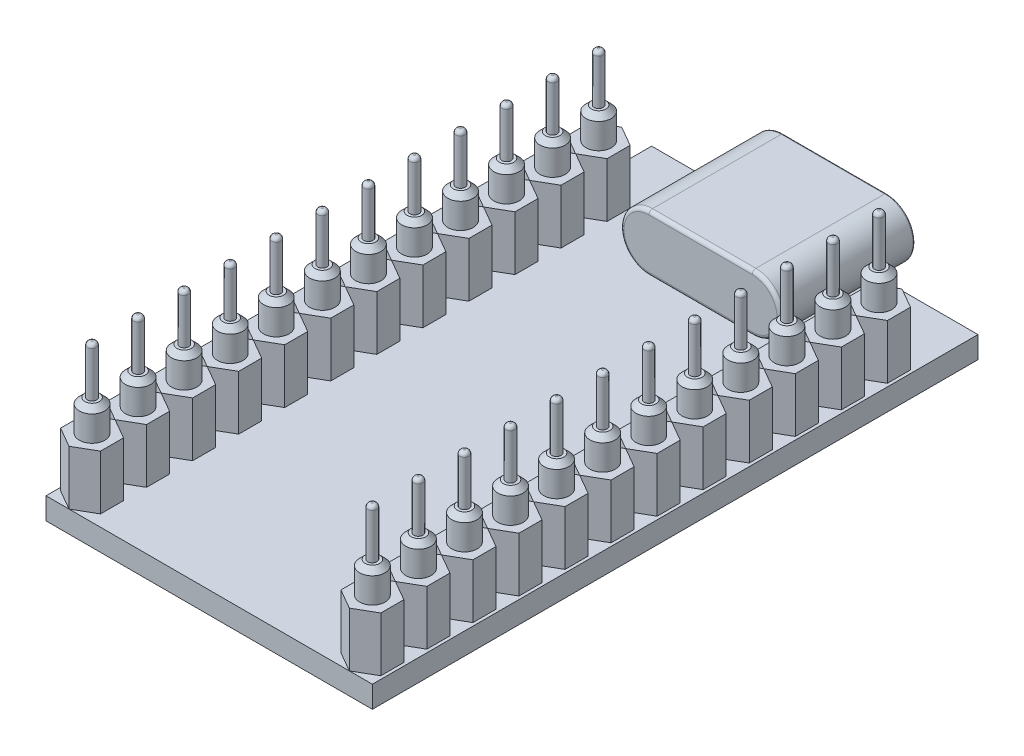
from build123d import *

# Parameters (mm, degrees)
SKETCH1_W                = 18
SKETCH1_H                = 33.4
BOSS_EXTRUDE1_DEPTH      = 1.2
BOSS_EXTRUDE2_DEPTH      = 1.1
BOSS_EXTRUDE2_DEPTH_BACK = 6.3
FILLET1_R                = 0.1
FILLET3_R                = 0.2
CUT_EXTRUDE2_DEPTH       = 7
FILLET4_R                = 0.1
SKETCH4_R                = 0.5
CUT_EXTRUDE3_DEPTH       = 7
CUT_EXTRUDE6_START       = 0.6
SKETCH7_R                = 1
CUT_EXTRUDE6_DEPTH       = 0.1
BOSS_EXTRUDE3_DEPTH      = 7.4
BOSS_EXTRUDE3_DEPTH_BACK = 1.6
SKETCH9_R                = 0.25
FILLET5_R                = 0.2
BOSS_EXTRUDE4_DEPTH      = 3
SKETCH11_R               = 0.7
BOSS_EXTRUDE5_DEPTH      = 4.7
CHAMFER1_SIZE            = 0.3
LPATTERN2_COUNT          = 12
LPATTERN2_PITCH          = 2.54


with BuildPart() as part:
    # Sketch1 → Boss-Extrude1 (new body)
    with BuildSketch(Plane(origin=(0, 0, 0), x_dir=(1, 0, 0), z_dir=(0, 1, 0))):
        Rectangle(SKETCH1_W, SKETCH1_H)
    extrude(amount=BOSS_EXTRUDE1_DEPTH)

    # Sketch4 → Cut-Extrude3 (cut)
    with BuildSketch(Plane(origin=(0, 1.2, 0), x_dir=(1, 0, 0), z_dir=(0, 1, 0))):
        with Locations(Location((-7.73, -15.43, 0), (0, 0, 270))):
            Circle(SKETCH4_R)
        with Locations(Location((-7.73, -12.89, 0), (0, 0, 270))):
            Circle(SKETCH4_R)
        with Locations(Location((-7.73, -10.35, 0), (0, 0, 270))):
            Circle(SKETCH4_R)
        with Locations(Location((-7.73, -7.81, 0), (0, 0, 270))):
            Circle(SKETCH4_R)
        with Locations(Location((-7.73, -5.27, 0), (0, 0, 270))):
            Circle(SKETCH4_R)
        with Locations(Location((-7.73, -2.73, 0), (0, 0, 270))):
            Circle(SKETCH4_R)
        with Locations(Location((-7.73, -0.19, 0), (0, 0, 270))):
            Circle(SKETCH4_R)
        with Locations(Location((-7.73, 2.35, 0), (0, 0, 270))):
            Circle(SKETCH4_R)
        with Locations(Location((-7.73, 4.89, 0), (0, 0, 270))):
            Circle(SKETCH4_R)
        with Locations(Location((-7.73, 7.43, 0), (0, 0, 270))):
            Circle(SKETCH4_R)
        with Locations(Location((-7.73, 9.97, 0), (0, 0, 270))):
            Circle(SKETCH4_R)
        with Locations(Location((-7.73, 12.51, 0), (0, 0, 270))):
            Circle(SKETCH4_R)
    cut_extrude3 = extrude(amount=-CUT_EXTRUDE3_DEPTH, mode=Mode.SUBTRACT)

    # Sketch7 → Cut-Extrude6 (cut)
    with BuildSketch(Plane(origin=(0, 0.6, 0), x_dir=(-1, 0, 0), z_dir=(0, -1, 0)).offset(CUT_EXTRUDE6_START)):
        with Locations(Location((7.73, -15.43, 0), (0, 0, 90))):
            Circle(SKETCH7_R)
        with Locations(Location((7.73, -12.89, 0), (0, 0, 90))):
            Circle(SKETCH7_R)
        with Locations(Location((7.73, -10.35, 0), (0, 0, 90))):
            Circle(SKETCH7_R)
        with Locations(Location((7.73, -7.81, 0), (0, 0, 90))):
            Circle(SKETCH7_R)
        with Locations(Location((7.73, -5.27, 0), (0, 0, 90))):
            Circle(SKETCH7_R)
        with Locations(Location((7.73, -2.73, 0), (0, 0, 90))):
            Circle(SKETCH7_R)
        with Locations(Location((7.73, -0.19, 0), (0, 0, 90))):
            Circle(SKETCH7_R)
        with Locations(Location((7.73, 2.35, 0), (0, 0, 90))):
            Circle(SKETCH7_R)
        with Locations(Location((7.73, 4.89, 0), (0, 0, 90))):
            Circle(SKETCH7_R)
        with Locations(Location((7.73, 7.43, 0), (0, 0, 90))):
            Circle(SKETCH7_R)
        with Locations(Location((7.73, 9.97, 0), (0, 0, 90))):
            Circle(SKETCH7_R)
        with Locations(Location((7.73, 12.51, 0), (0, 0, 90))):
            Circle(SKETCH7_R)
    cut_extrude6 = extrude(amount=-CUT_EXTRUDE6_DEPTH, mode=Mode.SUBTRACT)

    # Mirror5: Cut-Extrude3, Cut-Extrude6 across plane
    add(cut_extrude3.mirror(Plane(origin=(0, 0, 0), x_dir=(0, 0, 1), z_dir=(1, 0, 0))), mode=Mode.SUBTRACT)
    add(cut_extrude6.mirror(Plane(origin=(0, 0, 0), x_dir=(0, 0, 1), z_dir=(1, 0, 0))), mode=Mode.SUBTRACT)


with BuildPart() as body_2:
    # Sketch2 → Boss-Extrude2 (new, two sides: drawn at the far end of the back side and taken through both)
    with BuildSketch(Plane(origin=(0, 0, -16.7), x_dir=(-1, 0, 0), z_dir=(0, 0, -1)).offset(-BOSS_EXTRUDE2_DEPTH_BACK)):
        with BuildLine():
            Line((-2.85, 4.34), (2.85, 4.34))
            ThreePointArc((2.85, 4.34), (4.42, 2.77), (2.85, 1.2))
            Line((2.85, 1.2), (-2.85, 1.2))
            ThreePointArc((-2.85, 1.2), (-4.42, 2.77), (-2.85, 4.34))
        make_face()
    extrude(amount=BOSS_EXTRUDE2_DEPTH + BOSS_EXTRUDE2_DEPTH_BACK)

    # Fillet1
    fillet1_edges = [body_2.edges().sort_by_distance(p)[0] for p in [
        (4.42, 2.77, -17.8),
        (0, 1.2, -17.8),
        (-4.42, 2.77, -17.8),
        (0, 4.34, -17.8),
    ]]
    fillet(fillet1_edges, radius=FILLET1_R)

    # Fillet3
    fillet3_edges = [body_2.edges().sort_by_distance(p)[0] for p in [
        (-4.42, 2.77, -10.4),
        (0, 4.34, -10.4),
        (4.42, 2.77, -10.4),
        (0, 1.2, -10.4),
    ]]
    fillet(fillet3_edges, radius=FILLET3_R)

    # Sketch3 → Cut-Extrude2 (cut)
    with BuildSketch(Plane(origin=(0, 0, -17.8), x_dir=(-1, 0, 0), z_dir=(0, 0, -1))):
        with BuildLine():
            Line((-2.85, 1.5), (2.85, 1.5))
            ThreePointArc((2.85, 1.5), (4.12, 2.77), (2.85, 4.04))
            Line((2.85, 4.04), (-2.85, 4.04))
            ThreePointArc((-2.85, 4.04), (-4.12, 2.77), (-2.85, 1.5))
        make_face()
        with BuildLine():
            Line((-2.85, 3.02), (2.85, 3.02))
            ThreePointArc((2.85, 3.02), (3.1, 2.77), (2.85, 2.52))
            Line((2.85, 2.52), (-2.85, 2.52))
            ThreePointArc((-2.85, 2.52), (-3.1, 2.77), (-2.85, 3.02))
        make_face(mode=Mode.SUBTRACT)
    extrude(amount=-CUT_EXTRUDE2_DEPTH, mode=Mode.SUBTRACT)

    # Fillet4
    fillet4_edges = [body_2.edges().sort_by_distance(p)[0] for p in [
        (4.12, 2.77, -17.8),
        (0, 1.5, -17.8),
        (-4.12, 2.77, -17.8),
        (0, 4.04, -17.8),
        (3.1, 2.77, -17.8),
        (0, 3.02, -17.8),
        (-3.1, 2.77, -17.8),
        (0, 2.52, -17.8),
    ]]
    fillet(fillet4_edges, radius=FILLET4_R)


with BuildPart() as body_3:
    # Sketch9 → Boss-Extrude3 (new, two sides: drawn at the far end of the back side and taken through both)
    with BuildSketch(Plane(origin=(0, 1.2, 0), x_dir=(1, 0, 0), z_dir=(0, 1, 0)).offset(-BOSS_EXTRUDE3_DEPTH_BACK)):
        with Locations(Location((-7.73, -15.43, 0), (0, 0, 270))):
            Circle(SKETCH9_R)
    extrude(amount=BOSS_EXTRUDE3_DEPTH + BOSS_EXTRUDE3_DEPTH_BACK)

    # Fillet5
    fillet5_edges = [body_3.edges().sort_by_distance(p)[0] for p in [
        (-7.73, 8.6, 15.18),
        (-7.73, -0.4, 15.18),
    ]]
    fillet(fillet5_edges, radius=FILLET5_R)


with BuildPart() as body_4:
    # Sketch10 → Boss-Extrude4 (new body)
    with BuildSketch(Plane(origin=(0, 1.2, 0), x_dir=(1, 0, 0), z_dir=(0, 1, 0))):
        Polygon((-8.829852263, -14.795), (-8.829852263, -16.065), (-7.73, -16.7), (-6.630147737, -16.065), (-6.630147737, -14.795), (-7.73, -14.16), align=None)
    extrude(amount=BOSS_EXTRUDE4_DEPTH)


with BuildPart() as body_5:
    # Sketch11 → Boss-Extrude5 (new body)
    with BuildSketch(Plane(origin=(0, 1.2, 0), x_dir=(1, 0, 0), z_dir=(0, 1, 0))):
        with Locations(Location((-7.73, -15.43, 0), (0, 0, 270))):
            Circle(SKETCH11_R)
    extrude(amount=BOSS_EXTRUDE5_DEPTH)

    # Chamfer1
    chamfer1_edges = [body_5.edges().sort_by_distance(p)[0] for p in [
        (-7.73, 5.9, 14.73),
    ]]
    chamfer(chamfer1_edges, length=CHAMFER1_SIZE)


with BuildPart() as lpattern2_1:
    # LPattern2: pattern copy
    add(body_3.part.moved(Location(Vector(0, 0, -1) * (1 * LPATTERN2_PITCH))))


with BuildPart() as lpattern2_2:
    # LPattern2: pattern copy
    add(body_3.part.moved(Location(Vector(0, 0, -1) * (2 * LPATTERN2_PITCH))))


with BuildPart() as lpattern2_3:
    # LPattern2: pattern copy
    add(body_3.part.moved(Location(Vector(0, 0, -1) * (3 * LPATTERN2_PITCH))))


with BuildPart() as lpattern2_4:
    # LPattern2: pattern copy
    add(body_3.part.moved(Location(Vector(0, 0, -1) * (4 * LPATTERN2_PITCH))))


with BuildPart() as lpattern2_5:
    # LPattern2: pattern copy
    add(body_3.part.moved(Location(Vector(0, 0, -1) * (5 * LPATTERN2_PITCH))))


with BuildPart() as lpattern2_6:
    # LPattern2: pattern copy
    add(body_3.part.moved(Location(Vector(0, 0, -1) * (6 * LPATTERN2_PITCH))))


with BuildPart() as lpattern2_7:
    # LPattern2: pattern copy
    add(body_3.part.moved(Location(Vector(0, 0, -1) * (7 * LPATTERN2_PITCH))))


with BuildPart() as lpattern2_8:
    # LPattern2: pattern copy
    add(body_3.part.moved(Location(Vector(0, 0, -1) * (8 * LPATTERN2_PITCH))))


with BuildPart() as lpattern2_9:
    # LPattern2: pattern copy
    add(body_3.part.moved(Location(Vector(0, 0, -1) * (9 * LPATTERN2_PITCH))))


with BuildPart() as lpattern2_10:
    # LPattern2: pattern copy
    add(body_3.part.moved(Location(Vector(0, 0, -1) * (10 * LPATTERN2_PITCH))))


with BuildPart() as lpattern2_11:
    # LPattern2: pattern copy
    add(body_3.part.moved(Location(Vector(0, 0, -1) * (11 * LPATTERN2_PITCH))))


with BuildPart() as lpattern2_12:
    # LPattern2: pattern copy
    add(body_5.part.moved(Location(Vector(0, 0, -1) * (1 * LPATTERN2_PITCH))))


with BuildPart() as lpattern2_13:
    # LPattern2: pattern copy
    add(body_5.part.moved(Location(Vector(0, 0, -1) * (2 * LPATTERN2_PITCH))))


with BuildPart() as lpattern2_14:
    # LPattern2: pattern copy
    add(body_5.part.moved(Location(Vector(0, 0, -1) * (3 * LPATTERN2_PITCH))))


with BuildPart() as lpattern2_15:
    # LPattern2: pattern copy
    add(body_5.part.moved(Location(Vector(0, 0, -1) * (4 * LPATTERN2_PITCH))))


with BuildPart() as lpattern2_16:
    # LPattern2: pattern copy
    add(body_5.part.moved(Location(Vector(0, 0, -1) * (5 * LPATTERN2_PITCH))))


with BuildPart() as lpattern2_17:
    # LPattern2: pattern copy
    add(body_5.part.moved(Location(Vector(0, 0, -1) * (6 * LPATTERN2_PITCH))))


with BuildPart() as lpattern2_18:
    # LPattern2: pattern copy
    add(body_5.part.moved(Location(Vector(0, 0, -1) * (7 * LPATTERN2_PITCH))))


with BuildPart() as lpattern2_19:
    # LPattern2: pattern copy
    add(body_5.part.moved(Location(Vector(0, 0, -1) * (8 * LPATTERN2_PITCH))))


with BuildPart() as lpattern2_20:
    # LPattern2: pattern copy
    add(body_5.part.moved(Location(Vector(0, 0, -1) * (9 * LPATTERN2_PITCH))))


with BuildPart() as lpattern2_21:
    # LPattern2: pattern copy
    add(body_5.part.moved(Location(Vector(0, 0, -1) * (10 * LPATTERN2_PITCH))))


with BuildPart() as lpattern2_22:
    # LPattern2: pattern copy
    add(body_5.part.moved(Location(Vector(0, 0, -1) * (11 * LPATTERN2_PITCH))))


with BuildPart() as lpattern2_23:
    # LPattern2: pattern copy
    add(body_4.part.moved(Location(Vector(0, 0, -1) * (1 * LPATTERN2_PITCH))))


with BuildPart() as lpattern2_24:
    # LPattern2: pattern copy
    add(body_4.part.moved(Location(Vector(0, 0, -1) * (2 * LPATTERN2_PITCH))))


with BuildPart() as lpattern2_25:
    # LPattern2: pattern copy
    add(body_4.part.moved(Location(Vector(0, 0, -1) * (3 * LPATTERN2_PITCH))))


with BuildPart() as lpattern2_26:
    # LPattern2: pattern copy
    add(body_4.part.moved(Location(Vector(0, 0, -1) * (4 * LPATTERN2_PITCH))))


with BuildPart() as lpattern2_27:
    # LPattern2: pattern copy
    add(body_4.part.moved(Location(Vector(0, 0, -1) * (5 * LPATTERN2_PITCH))))


with BuildPart() as lpattern2_28:
    # LPattern2: pattern copy
    add(body_4.part.moved(Location(Vector(0, 0, -1) * (6 * LPATTERN2_PITCH))))


with BuildPart() as lpattern2_29:
    # LPattern2: pattern copy
    add(body_4.part.moved(Location(Vector(0, 0, -1) * (7 * LPATTERN2_PITCH))))


with BuildPart() as lpattern2_30:
    # LPattern2: pattern copy
    add(body_4.part.moved(Location(Vector(0, 0, -1) * (8 * LPATTERN2_PITCH))))


with BuildPart() as lpattern2_31:
    # LPattern2: pattern copy
    add(body_4.part.moved(Location(Vector(0, 0, -1) * (9 * LPATTERN2_PITCH))))


with BuildPart() as lpattern2_32:
    # LPattern2: pattern copy
    add(body_4.part.moved(Location(Vector(0, 0, -1) * (10 * LPATTERN2_PITCH))))


with BuildPart() as lpattern2_33:
    # LPattern2: pattern copy
    add(body_4.part.moved(Location(Vector(0, 0, -1) * (11 * LPATTERN2_PITCH))))


with BuildPart() as body_39:
    # Mirror2: mirrored copy
    add(lpattern2_6.part.mirror(Plane(origin=(0, 0, 0), x_dir=(0, 0, 1), z_dir=(1, 0, 0))))


with BuildPart() as body_40:
    # Mirror2 2: mirrored copy
    add(lpattern2_13.part.mirror(Plane(origin=(0, 0, 0), x_dir=(0, 0, 1), z_dir=(1, 0, 0))))


with BuildPart() as body_41:
    # Mirror2 3: mirrored copy
    add(lpattern2_10.part.mirror(Plane(origin=(0, 0, 0), x_dir=(0, 0, 1), z_dir=(1, 0, 0))))


with BuildPart() as body_42:
    # Mirror2 4: mirrored copy
    add(lpattern2_18.part.mirror(Plane(origin=(0, 0, 0), x_dir=(0, 0, 1), z_dir=(1, 0, 0))))


with BuildPart() as body_43:
    # Mirror2 5: mirrored copy
    add(lpattern2_29.part.mirror(Plane(origin=(0, 0, 0), x_dir=(0, 0, 1), z_dir=(1, 0, 0))))


with BuildPart() as body_44:
    # Mirror2 6: mirrored copy
    add(lpattern2_23.part.mirror(Plane(origin=(0, 0, 0), x_dir=(0, 0, 1), z_dir=(1, 0, 0))))


with BuildPart() as body_45:
    # Mirror2 7: mirrored copy
    add(lpattern2_1.part.mirror(Plane(origin=(0, 0, 0), x_dir=(0, 0, 1), z_dir=(1, 0, 0))))


with BuildPart() as body_46:
    # Mirror2 8: mirrored copy
    add(body_5.part.mirror(Plane(origin=(0, 0, 0), x_dir=(0, 0, 1), z_dir=(1, 0, 0))))


with BuildPart() as body_47:
    # Mirror2 9: mirrored copy
    add(lpattern2_5.part.mirror(Plane(origin=(0, 0, 0), x_dir=(0, 0, 1), z_dir=(1, 0, 0))))


with BuildPart() as body_48:
    # Mirror2 10: mirrored copy
    add(lpattern2_16.part.mirror(Plane(origin=(0, 0, 0), x_dir=(0, 0, 1), z_dir=(1, 0, 0))))


with BuildPart() as body_49:
    # Mirror2 11: mirrored copy
    add(lpattern2_28.part.mirror(Plane(origin=(0, 0, 0), x_dir=(0, 0, 1), z_dir=(1, 0, 0))))


with BuildPart() as body_50:
    # Mirror2 12: mirrored copy
    add(body_4.part.mirror(Plane(origin=(0, 0, 0), x_dir=(0, 0, 1), z_dir=(1, 0, 0))))


with BuildPart() as body_51:
    # Mirror2 13: mirrored copy
    add(lpattern2_9.part.mirror(Plane(origin=(0, 0, 0), x_dir=(0, 0, 1), z_dir=(1, 0, 0))))


with BuildPart() as body_52:
    # Mirror2 14: mirrored copy
    add(lpattern2_21.part.mirror(Plane(origin=(0, 0, 0), x_dir=(0, 0, 1), z_dir=(1, 0, 0))))


with BuildPart() as body_53:
    # Mirror2 15: mirrored copy
    add(lpattern2_33.part.mirror(Plane(origin=(0, 0, 0), x_dir=(0, 0, 1), z_dir=(1, 0, 0))))


with BuildPart() as body_54:
    # Mirror2 16: mirrored copy
    add(lpattern2_14.part.mirror(Plane(origin=(0, 0, 0), x_dir=(0, 0, 1), z_dir=(1, 0, 0))))


with BuildPart() as body_55:
    # Mirror2 17: mirrored copy
    add(lpattern2_27.part.mirror(Plane(origin=(0, 0, 0), x_dir=(0, 0, 1), z_dir=(1, 0, 0))))


with BuildPart() as body_56:
    # Mirror2 18: mirrored copy
    add(lpattern2_4.part.mirror(Plane(origin=(0, 0, 0), x_dir=(0, 0, 1), z_dir=(1, 0, 0))))


with BuildPart() as body_57:
    # Mirror2 19: mirrored copy
    add(lpattern2_19.part.mirror(Plane(origin=(0, 0, 0), x_dir=(0, 0, 1), z_dir=(1, 0, 0))))


with BuildPart() as body_58:
    # Mirror2 20: mirrored copy
    add(lpattern2_8.part.mirror(Plane(origin=(0, 0, 0), x_dir=(0, 0, 1), z_dir=(1, 0, 0))))


with BuildPart() as body_59:
    # Mirror2 21: mirrored copy
    add(lpattern2_32.part.mirror(Plane(origin=(0, 0, 0), x_dir=(0, 0, 1), z_dir=(1, 0, 0))))


with BuildPart() as body_60:
    # Mirror2 22: mirrored copy
    add(lpattern2_12.part.mirror(Plane(origin=(0, 0, 0), x_dir=(0, 0, 1), z_dir=(1, 0, 0))))


with BuildPart() as body_61:
    # Mirror2 23: mirrored copy
    add(lpattern2_26.part.mirror(Plane(origin=(0, 0, 0), x_dir=(0, 0, 1), z_dir=(1, 0, 0))))


with BuildPart() as body_62:
    # Mirror2 24: mirrored copy
    add(lpattern2_17.part.mirror(Plane(origin=(0, 0, 0), x_dir=(0, 0, 1), z_dir=(1, 0, 0))))


with BuildPart() as body_63:
    # Mirror2 25: mirrored copy
    add(lpattern2_3.part.mirror(Plane(origin=(0, 0, 0), x_dir=(0, 0, 1), z_dir=(1, 0, 0))))


with BuildPart() as body_64:
    # Mirror2 26: mirrored copy
    add(lpattern2_22.part.mirror(Plane(origin=(0, 0, 0), x_dir=(0, 0, 1), z_dir=(1, 0, 0))))


with BuildPart() as body_65:
    # Mirror2 27: mirrored copy
    add(lpattern2_31.part.mirror(Plane(origin=(0, 0, 0), x_dir=(0, 0, 1), z_dir=(1, 0, 0))))


with BuildPart() as body_66:
    # Mirror2 28: mirrored copy
    add(body_3.part.mirror(Plane(origin=(0, 0, 0), x_dir=(0, 0, 1), z_dir=(1, 0, 0))))


with BuildPart() as body_67:
    # Mirror2 29: mirrored copy
    add(lpattern2_7.part.mirror(Plane(origin=(0, 0, 0), x_dir=(0, 0, 1), z_dir=(1, 0, 0))))


with BuildPart() as body_68:
    # Mirror2 30: mirrored copy
    add(lpattern2_25.part.mirror(Plane(origin=(0, 0, 0), x_dir=(0, 0, 1), z_dir=(1, 0, 0))))


with BuildPart() as body_69:
    # Mirror2 31: mirrored copy
    add(lpattern2_11.part.mirror(Plane(origin=(0, 0, 0), x_dir=(0, 0, 1), z_dir=(1, 0, 0))))


with BuildPart() as body_70:
    # Mirror2 32: mirrored copy
    add(lpattern2_15.part.mirror(Plane(origin=(0, 0, 0), x_dir=(0, 0, 1), z_dir=(1, 0, 0))))


with BuildPart() as body_71:
    # Mirror2 33: mirrored copy
    add(lpattern2_20.part.mirror(Plane(origin=(0, 0, 0), x_dir=(0, 0, 1), z_dir=(1, 0, 0))))


with BuildPart() as body_72:
    # Mirror2 34: mirrored copy
    add(lpattern2_30.part.mirror(Plane(origin=(0, 0, 0), x_dir=(0, 0, 1), z_dir=(1, 0, 0))))


with BuildPart() as body_73:
    # Mirror2 35: mirrored copy
    add(lpattern2_2.part.mirror(Plane(origin=(0, 0, 0), x_dir=(0, 0, 1), z_dir=(1, 0, 0))))


with BuildPart() as body_74:
    # Mirror2 36: mirrored copy
    add(lpattern2_24.part.mirror(Plane(origin=(0, 0, 0), x_dir=(0, 0, 1), z_dir=(1, 0, 0))))


solid = Compound([part.part, body_2.part, body_3.part, body_4.part, body_5.part, lpattern2_1.part, lpattern2_2.part, lpattern2_3.part, lpattern2_4.part, lpattern2_5.part, lpattern2_6.part, lpattern2_7.part, lpattern2_8.part, lpattern2_9.part, lpattern2_10.part, lpattern2_11.part, lpattern2_12.part, lpattern2_13.part, lpattern2_14.part, lpattern2_15.part, lpattern2_16.part, lpattern2_17.part, lpattern2_18.part, lpattern2_19.part, lpattern2_20.part, lpattern2_21.part, lpattern2_22.part, lpattern2_23.part, lpattern2_24.part, lpattern2_25.part, lpattern2_26.part, lpattern2_27.part, lpattern2_28.part, lpattern2_29.part, lpattern2_30.part, lpattern2_31.part, lpattern2_32.part, lpattern2_33.part, body_39.part, body_40.part, body_41.part, body_42.part, body_43.part, body_44.part, body_45.part, body_46.part, body_47.part, body_48.part, body_49.part, body_50.part, body_51.part, body_52.part, body_53.part, body_54.part, body_55.part, body_56.part, body_57.part, body_58.part, body_59.part, body_60.part, body_61.part, body_62.part, body_63.part, body_64.part, body_65.part, body_66.part, body_67.part, body_68.part, body_69.part, body_70.part, body_71.part, body_72.part, body_73.part, body_74.part])
